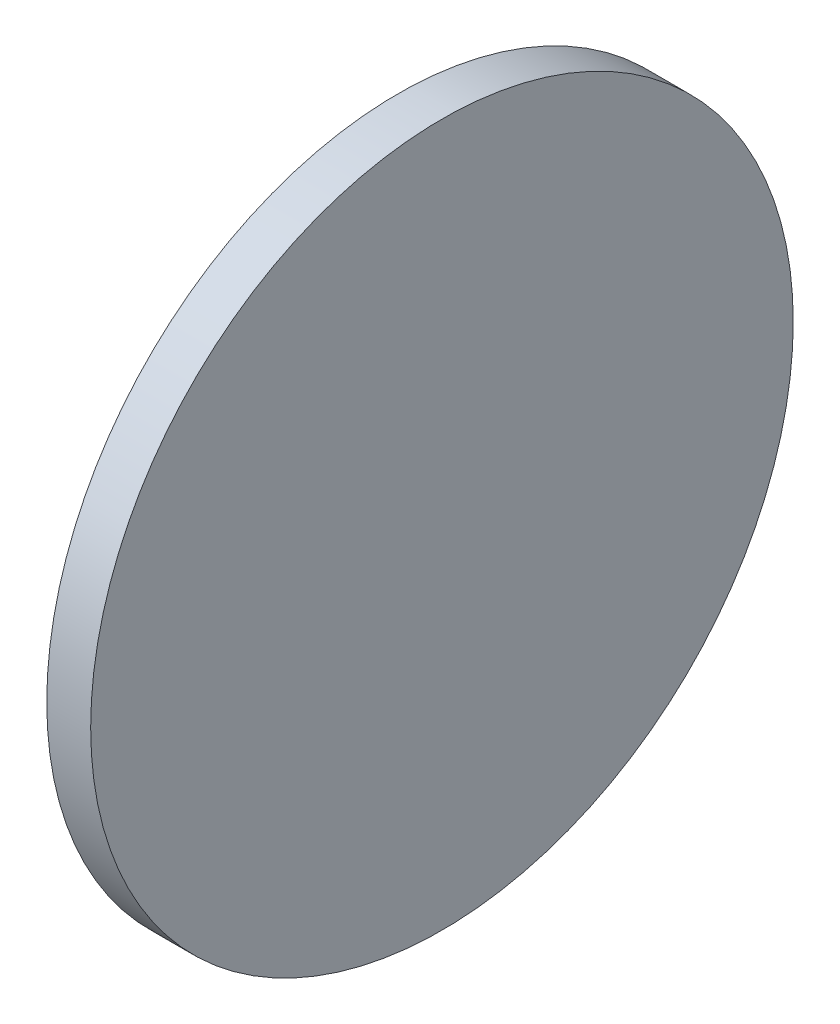
from build123d import *

# Parameters (mm, degrees)
AXIAL_PROFILE_MM_W = 3.175
AXIAL_PROFILE_MM_H = 25.4


with BuildPart() as part:
    # Axial profile (mm) → Full revolution (revolve)
    with BuildSketch(Plane.XY, mode=Mode.PRIVATE) as full_revolution_sk:
        with Locations((170.2875, 12.7)):
            Rectangle(AXIAL_PROFILE_MM_W, AXIAL_PROFILE_MM_H)
    revolve(full_revolution_sk.sketch.rotate(Axis((-110, 0, 0), (1, 0, 0)), 90), axis=Axis((-110, 0, 0), (1, 0, 0)))


solid = part.part
